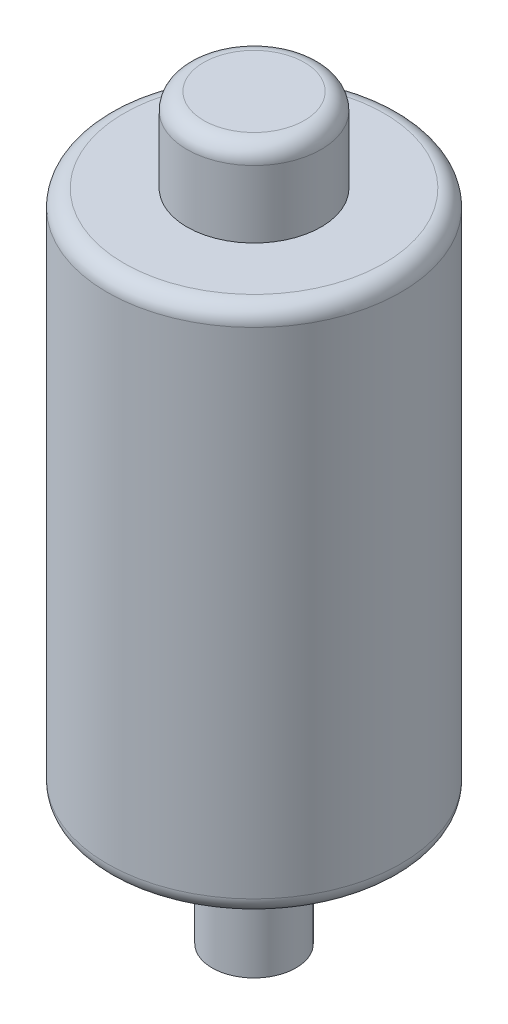
from build123d import *

# Parameters (mm, degrees)
SKETCH1_R           = 6.35
BOSS_EXTRUDE1_DEPTH = 19.05
SKETCH3_R           = 22.225
BOSS_EXTRUDE2_DEPTH = 80.01
SKETCH4_R           = 10.16
BOSS_EXTRUDE3_DEPTH = 12.7
FILLET2_R           = 2.54
FILLET3_R           = 2.54
FILLET4_R           = 2.54
SKETCH5_R           = 0.948603759
CUT_EXTRUDE1_DEPTH  = 2.54


with BuildPart() as part:
    # Sketch1 → Boss-Extrude1 (new body)
    with BuildSketch(Plane(origin=(0, 0, 0), x_dir=(1, 0, 0), z_dir=(0, 1, 0))):
        with Locations(Location((0, 0, 0), (0, 0, 90))):
            Circle(SKETCH1_R)
    extrude(amount=BOSS_EXTRUDE1_DEPTH)

    # Sketch3 → Boss-Extrude2 (add)
    with BuildSketch(Plane(origin=(0, 19.05, 0), x_dir=(1, 0, 0), z_dir=(0, 1, 0))):
        with Locations(Location((0, 0, 0), (0, 0, 270))):
            Circle(SKETCH3_R)
    extrude(amount=BOSS_EXTRUDE2_DEPTH)

    # Sketch4 → Boss-Extrude3 (add)
    with BuildSketch(Plane(origin=(0, 99.06, 0), x_dir=(1, 0, 0), z_dir=(0, 1, 0))):
        with Locations(Location((0, 0, 0), (0, 0, 270))):
            Circle(SKETCH4_R)
    extrude(amount=BOSS_EXTRUDE3_DEPTH)

    # Fillet2
    fillet2_edges = [part.edges().sort_by_distance(p)[0] for p in [
        (0, 111.76, -10.16),
    ]]
    fillet(fillet2_edges, radius=FILLET2_R)

    # Fillet3
    fillet3_edges = [part.edges().sort_by_distance(p)[0] for p in [
        (0, 99.06, -22.225),
    ]]
    fillet(fillet3_edges, radius=FILLET3_R)

    # Fillet4
    fillet4_edges = [part.edges().sort_by_distance(p)[0] for p in [
        (0, 19.05, -22.225),
    ]]
    fillet(fillet4_edges, radius=FILLET4_R)

    # Sketch5 → Cut-Extrude1 (cut)
    with BuildSketch(Plane(origin=(0, 0, -10.16), x_dir=(-1, 0, 0), z_dir=(0, 0, -1))):
        with Locations((0, 104.531305945)):
            Circle(SKETCH5_R)
    extrude(amount=-CUT_EXTRUDE1_DEPTH, mode=Mode.SUBTRACT)


solid = part.part
